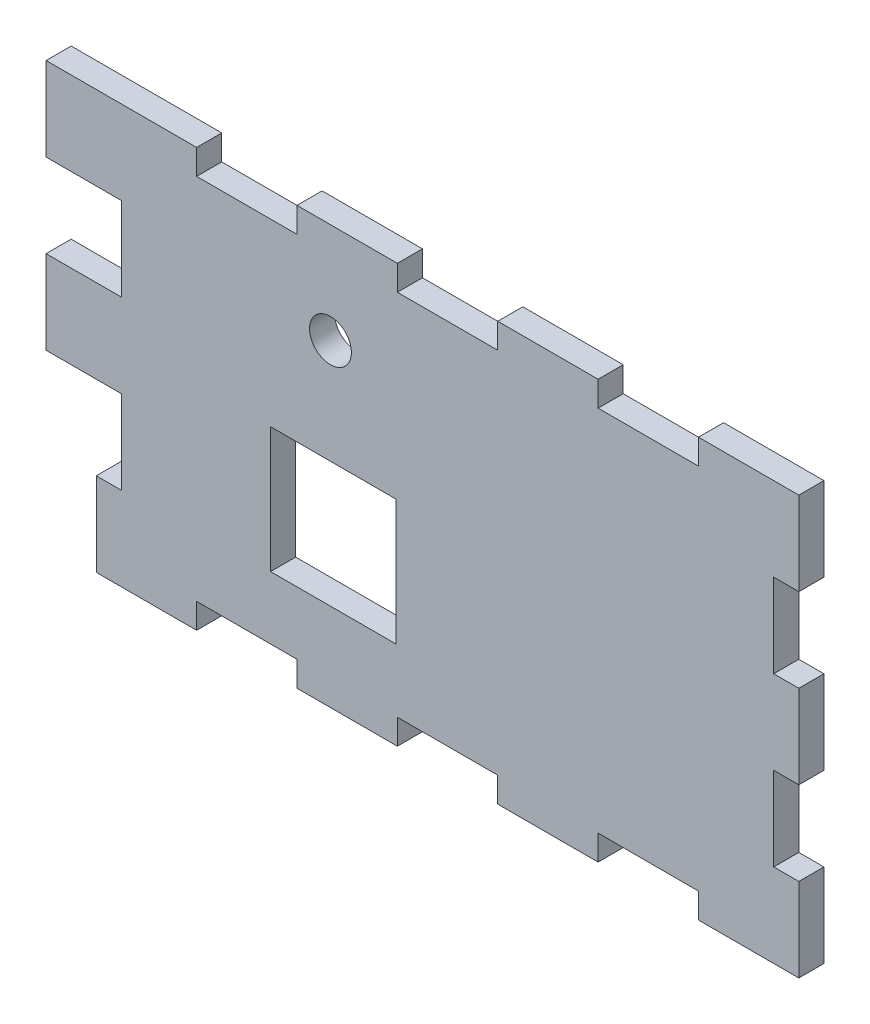
from build123d import *

# Parameters (mm, degrees)
ESBO_O4_W                = 84
ESBO_O4_H                = 50
RESSALTO_EXTRUS_O2_DEPTH = 3
CORTE_EXTRUS_O2_REACH    = 50.969
ESBO_O5_W                = 12
ESBO_O5_H                = 3
CORTE_EXTRUS_O4_REACH    = 50.969
ESBO_O6_W                = 3
ESBO_O6_H                = 10
CORTE_EXTRUS_O5_REACH    = 50.969
ESBO_O8_R                = 2.5
ESBO_O8_W                = 15
ESBO_O8_H                = 15
ESBO_O11_W               = 3
ESBO_O11_H               = 10
RESSALTO_EXTRUS_O4_DEPTH = 6


with BuildPart() as part:
    # Esboço4 → Ressalto-extrusão2 (new body)
    with BuildSketch(Plane.XY):
        Rectangle(ESBO_O4_W, ESBO_O4_H)
    extrude(amount=RESSALTO_EXTRUS_O2_DEPTH)

    # Esboço5 → Corte-extrusão2 (cut, up to next)
    with BuildSketch(Plane.XY.offset(3), mode=Mode.PRIVATE) as corte_extrus_o2_sk1:
        with Locations((24, 23.5)):
            Rectangle(ESBO_O5_W, ESBO_O5_H)
    corte_extrus_o2_tool1 = extrude(corte_extrus_o2_sk1.sketch, amount=-CORTE_EXTRUS_O2_REACH, mode=Mode.PRIVATE) & part.part
    # Esboço5 → Corte-extrusão2 (cut, up to next)
    with BuildSketch(Plane.XY.offset(3), mode=Mode.PRIVATE) as corte_extrus_o2_sk2:
        with Locations((-24, 23.5)):
            Rectangle(ESBO_O5_W, ESBO_O5_H)
    corte_extrus_o2_tool2 = extrude(corte_extrus_o2_sk2.sketch, amount=-CORTE_EXTRUS_O2_REACH, mode=Mode.PRIVATE) & part.part
    # Esboço5 → Corte-extrusão2 (cut, up to next)
    with BuildSketch(Plane.XY.offset(3), mode=Mode.PRIVATE) as corte_extrus_o2_sk3:
        with Locations((0, 23.5)):
            Rectangle(ESBO_O5_W, ESBO_O5_H)
    corte_extrus_o2_tool3 = extrude(corte_extrus_o2_sk3.sketch, amount=-CORTE_EXTRUS_O2_REACH, mode=Mode.PRIVATE) & part.part
    # Esboço5 → Corte-extrusão2 (cut, up to next)
    with BuildSketch(Plane.XY.offset(3), mode=Mode.PRIVATE) as corte_extrus_o2_sk4:
        with Locations((0, -23.5)):
            Rectangle(ESBO_O5_W, ESBO_O5_H)
    corte_extrus_o2_tool4 = extrude(corte_extrus_o2_sk4.sketch, amount=-CORTE_EXTRUS_O2_REACH, mode=Mode.PRIVATE) & part.part
    # Esboço5 → Corte-extrusão2 (cut, up to next)
    with BuildSketch(Plane.XY.offset(3), mode=Mode.PRIVATE) as corte_extrus_o2_sk5:
        with Locations((-24, -23.5)):
            Rectangle(ESBO_O5_W, ESBO_O5_H)
    corte_extrus_o2_tool5 = extrude(corte_extrus_o2_sk5.sketch, amount=-CORTE_EXTRUS_O2_REACH, mode=Mode.PRIVATE) & part.part
    # Esboço5 → Corte-extrusão2 (cut, up to next)
    with BuildSketch(Plane.XY.offset(3), mode=Mode.PRIVATE) as corte_extrus_o2_sk6:
        with Locations((24, -23.5)):
            Rectangle(ESBO_O5_W, ESBO_O5_H)
    corte_extrus_o2_tool6 = extrude(corte_extrus_o2_sk6.sketch, amount=-CORTE_EXTRUS_O2_REACH, mode=Mode.PRIVATE) & part.part
    add(corte_extrus_o2_tool1.solids().sort_by_distance((24, 23.5, 3))[0], mode=Mode.SUBTRACT)
    add(corte_extrus_o2_tool2.solids().sort_by_distance((-24, 23.5, 3))[0], mode=Mode.SUBTRACT)
    add(corte_extrus_o2_tool3.solids().sort_by_distance((0, 23.5, 3))[0], mode=Mode.SUBTRACT)
    add(corte_extrus_o2_tool4.solids().sort_by_distance((0, -23.5, 3))[0], mode=Mode.SUBTRACT)
    add(corte_extrus_o2_tool5.solids().sort_by_distance((-24, -23.5, 3))[0], mode=Mode.SUBTRACT)
    add(corte_extrus_o2_tool6.solids().sort_by_distance((24, -23.5, 3))[0], mode=Mode.SUBTRACT)

    # Esboço6 → Corte-extrusão4 (cut, up to next)
    with BuildSketch(Plane.XY, mode=Mode.PRIVATE) as corte_extrus_o4_sk1:
        with Locations((40.5, 10)):
            Rectangle(ESBO_O6_W, ESBO_O6_H)
    corte_extrus_o4_tool1 = extrude(corte_extrus_o4_sk1.sketch, amount=CORTE_EXTRUS_O4_REACH, mode=Mode.PRIVATE) & part.part
    # Esboço6 → Corte-extrusão4 (cut, up to next)
    with BuildSketch(Plane.XY, mode=Mode.PRIVATE) as corte_extrus_o4_sk2:
        with Locations((-40.5, 10)):
            Rectangle(ESBO_O6_W, ESBO_O6_H)
    corte_extrus_o4_tool2 = extrude(corte_extrus_o4_sk2.sketch, amount=CORTE_EXTRUS_O4_REACH, mode=Mode.PRIVATE) & part.part
    # Esboço6 → Corte-extrusão4 (cut, up to next)
    with BuildSketch(Plane.XY, mode=Mode.PRIVATE) as corte_extrus_o4_sk3:
        with Locations((-40.5, -10)):
            Rectangle(ESBO_O6_W, ESBO_O6_H)
    corte_extrus_o4_tool3 = extrude(corte_extrus_o4_sk3.sketch, amount=CORTE_EXTRUS_O4_REACH, mode=Mode.PRIVATE) & part.part
    # Esboço6 → Corte-extrusão4 (cut, up to next)
    with BuildSketch(Plane.XY, mode=Mode.PRIVATE) as corte_extrus_o4_sk4:
        with Locations((40.5, -10)):
            Rectangle(ESBO_O6_W, ESBO_O6_H)
    corte_extrus_o4_tool4 = extrude(corte_extrus_o4_sk4.sketch, amount=CORTE_EXTRUS_O4_REACH, mode=Mode.PRIVATE) & part.part
    add(corte_extrus_o4_tool1.solids().sort_by_distance((40.5, 10, 0))[0], mode=Mode.SUBTRACT)
    add(corte_extrus_o4_tool2.solids().sort_by_distance((-40.5, 10, 0))[0], mode=Mode.SUBTRACT)
    add(corte_extrus_o4_tool3.solids().sort_by_distance((-40.5, -10, 0))[0], mode=Mode.SUBTRACT)
    add(corte_extrus_o4_tool4.solids().sort_by_distance((40.5, -10, 0))[0], mode=Mode.SUBTRACT)

    # Esboço8 → Corte-extrusão5 (cut, up to next)
    with BuildSketch(Plane(origin=(0, 0, 0), x_dir=(-1, 0, 0), z_dir=(0, 0, -1)), mode=Mode.PRIVATE) as corte_extrus_o5_sk1:
        with Locations((13.99726894, 13)):
            Circle(ESBO_O8_R)
    corte_extrus_o5_tool1 = extrude(corte_extrus_o5_sk1.sketch, amount=-CORTE_EXTRUS_O5_REACH, mode=Mode.PRIVATE) & part.part
    # Esboço8 → Corte-extrusão5 (cut, up to next)
    with BuildSketch(Plane(origin=(0, 0, 0), x_dir=(-1, 0, 0), z_dir=(0, 0, -1)), mode=Mode.PRIVATE) as corte_extrus_o5_sk2:
        with Locations((13.657630315, -7)):
            Rectangle(ESBO_O8_W, ESBO_O8_H)
    corte_extrus_o5_tool2 = extrude(corte_extrus_o5_sk2.sketch, amount=-CORTE_EXTRUS_O5_REACH, mode=Mode.PRIVATE) & part.part
    add(corte_extrus_o5_tool1.solids().sort_by_distance((-13.997269, 13, 0))[0], mode=Mode.SUBTRACT)
    add(corte_extrus_o5_tool2.solids().sort_by_distance((-13.65763, -7, 0))[0], mode=Mode.SUBTRACT)

    # Esboço11 → Ressalto-extrusão4 (add)
    with BuildSketch(Plane.ZY.offset(42)):
        with Locations((1.5, 0)):
            Rectangle(ESBO_O11_W, ESBO_O11_H)
        with Locations((1.5, 20)):
            Rectangle(ESBO_O11_W, ESBO_O11_H)
    extrude(amount=RESSALTO_EXTRUS_O4_DEPTH)


solid = part.part
